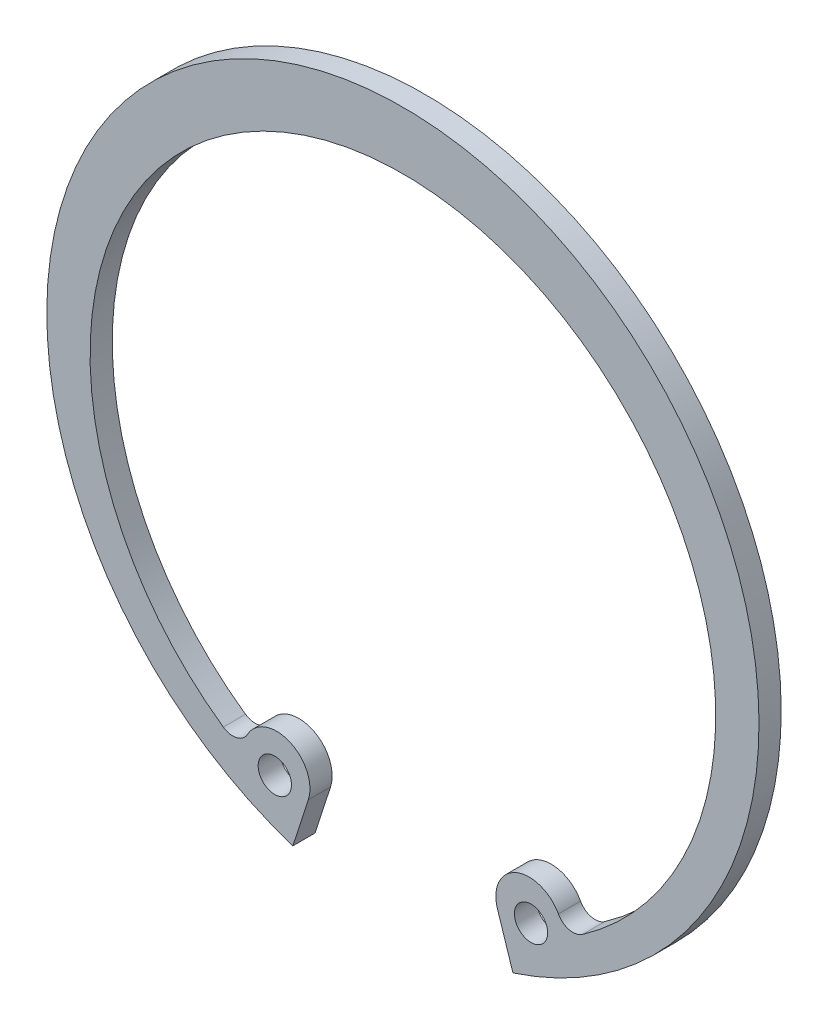
from build123d import *

# Parameters (mm, degrees)
SKETCH_1_R        = 1.5
EXTRUDE_876_DEPTH = 2


with BuildPart() as part:
    # 草图1 → Extrude 876 (new body)
    with BuildSketch(Plane.XY):
        with BuildLine():
            Line((-8.524963452, -26.237139671), (-9.919445519, -30.528914173))
            ThreePointArc((-9.919445519, -30.528914173), (0, 32.1), (9.919445519, -30.528914173))
            Line((9.919445519, -30.528914173), (8.524963452, -26.237139671))
            ThreePointArc((8.524963452, -26.237139671), (10.192802875, -22.554187295), (14.013442369, -23.876511159))
            ThreePointArc((14.013442369, -23.876511159), (14.988432972, -24.620058426), (16.192394641, -24.387796686))
            ThreePointArc((16.192394641, -24.387796686), (0, 26.9), (-16.192394641, -24.387796686))
            ThreePointArc((-16.192394641, -24.387796686), (-14.988432972, -24.620058426), (-14.013442369, -23.876511159))
            ThreePointArc((-14.013442369, -23.876511159), (-10.192802875, -22.554187295), (-8.524963452, -26.237139671))
        make_face()
        with Locations((-11.549074686, -25.8361931)):
            Circle(SKETCH_1_R, mode=Mode.SUBTRACT)
        with Locations(Location((11.549074686, -25.8361931, 0), (0, 0, 180))):
            Circle(SKETCH_1_R, mode=Mode.SUBTRACT)
    extrude(amount=EXTRUDE_876_DEPTH)


solid = part.part
